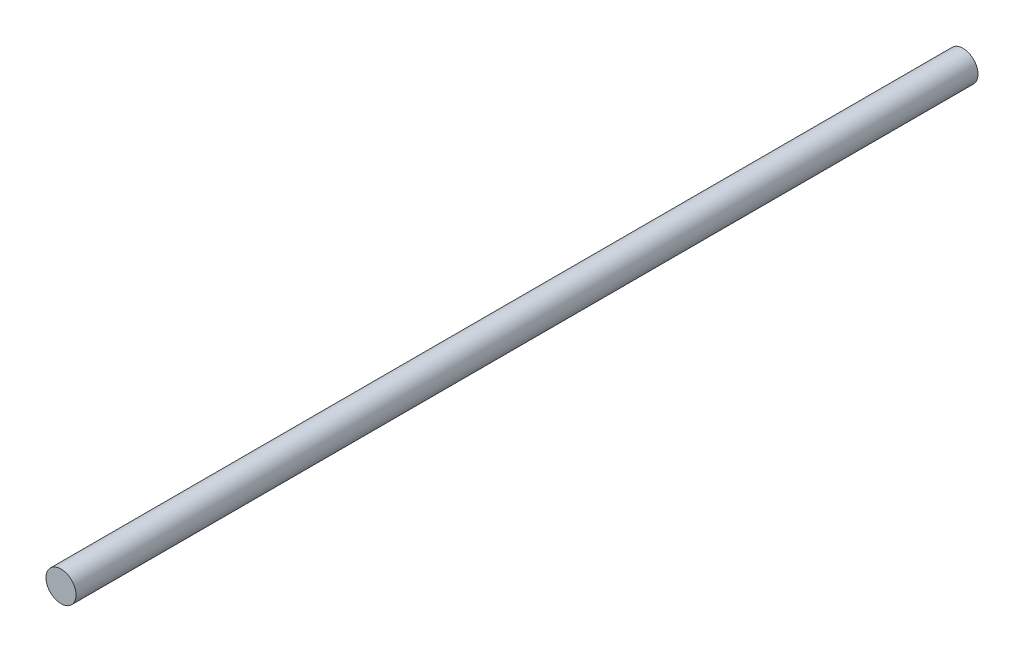
from build123d import *

# Parameters (mm, degrees)
ESQUISSE1_R        = 10
BOSS_EXTRU_1_DEPTH = 600


with BuildPart() as part:
    # Esquisse1 → Boss.-Extru.1 (new body)
    with BuildSketch(Plane.XY):
        Circle(ESQUISSE1_R)
    extrude(amount=BOSS_EXTRU_1_DEPTH)


solid = part.part
